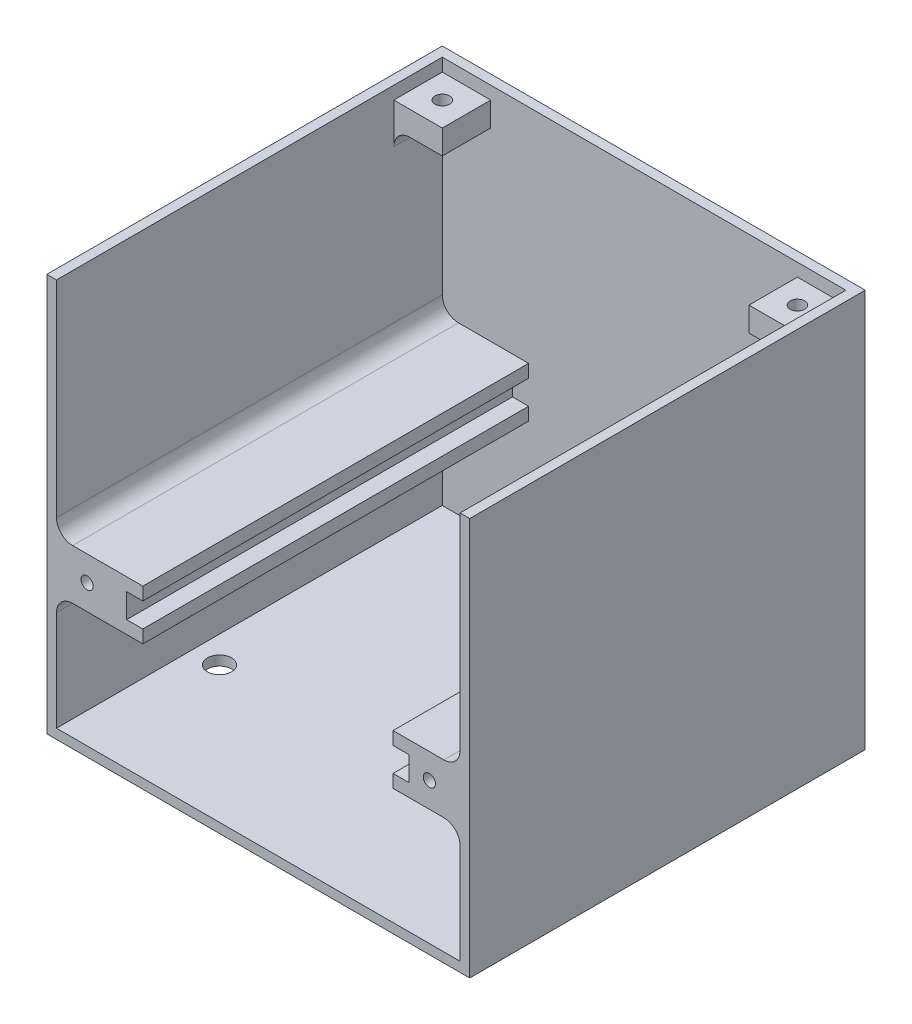
from build123d import *

# Parameters (mm, degrees)
SKETCH1_W           = 52.4
SKETCH1_H           = 49.3
BOSS_EXTRUDE1_DEPTH = 49
CUT_EXTRUDE1_DEPTH  = 47.8
SKETCH3_W           = 6
SKETCH3_H           = 3
BOSS_EXTRUDE2_DEPTH = 6
SKETCH4_R           = 0.75
CUT_EXTRUDE2_DEPTH  = 10
SKETCH5_R           = 1.5
CUT_EXTRUDE3_DEPTH  = 74.491836281
SKETCH6_R           = 0.9
CUT_EXTRUDE4_DEPTH  = 5
FILLET1_R           = 2


with BuildPart() as part:
    # Sketch1 → Boss-Extrude1 (new body)
    with BuildSketch(Plane.XY):
        with Locations((0, 24.65)):
            Rectangle(SKETCH1_W, SKETCH1_H)
    extrude(amount=BOSS_EXTRUDE1_DEPTH)

    # Sketch2 → Cut-Extrude1 (cut)
    with BuildSketch(Plane.XY.offset(49)):
        Polygon((25, 1.2), (25, 15.6), (16.7, 15.6), (16.7, 17.2), (18.7, 17.2), (18.7, 20.2), (16.7, 20.2), (16.7, 21.8), (25, 21.8), (25, 49.3), (-25, 49.3), (-25, 21.8), (-14.3, 21.8), (-14.3, 20.2), (-16.3, 20.2), (-16.3, 17.2), (-14.3, 17.2), (-14.3, 15.6), (-25, 15.6), (-25, 1.2), align=None)
    extrude(amount=-CUT_EXTRUDE1_DEPTH, mode=Mode.SUBTRACT)

    # Sketch3 → Boss-Extrude2 (add)
    with BuildSketch(Plane.XY.offset(1.2)):
        with Locations((-22, 46.2)):
            Rectangle(SKETCH3_W, SKETCH3_H)
        with Locations((22, 46.2)):
            Rectangle(SKETCH3_W, SKETCH3_H)
    extrude(amount=BOSS_EXTRUDE2_DEPTH)

    # Sketch4 → Cut-Extrude2 (cut)
    with BuildSketch(Plane.XY.offset(49)):
        with Locations((-21.2, 18.7)):
            Circle(SKETCH4_R)
        with Locations((21.2, 18.7)):
            Circle(SKETCH4_R)
    extrude(amount=-CUT_EXTRUDE2_DEPTH, mode=Mode.SUBTRACT)

    # Sketch5 → Cut-Extrude3 (cut, through all)
    with BuildSketch(Plane(origin=(0, 1.2, 0), x_dir=(1, 0, 0), z_dir=(0, 1, 0))):
        with Locations(Location((-21.7, -32.1, 0), (0, 0, 270))):
            Circle(SKETCH5_R)
        with Locations(Location((21.3, -27.6, 0), (0, 0, 270))):
            Circle(SKETCH5_R)
    extrude(amount=-CUT_EXTRUDE3_DEPTH, mode=Mode.SUBTRACT)

    # Sketch6 → Cut-Extrude4 (cut)
    with BuildSketch(Plane(origin=(0, 47.7, 0), x_dir=(1, 0, 0), z_dir=(0, 1, 0))):
        with Locations(Location((22, -4.2, 0), (0, 0, 180))):
            Circle(SKETCH6_R)
        with Locations(Location((-22, -4.2, 0), (0, 0, 180))):
            Circle(SKETCH6_R)
    extrude(amount=-CUT_EXTRUDE4_DEPTH, mode=Mode.SUBTRACT)

    # Fillet1
    fillet1_edges = [part.edges().sort_by_distance(p)[0] for p in [
        (-25, 15.6, 25.1),
        (-25, 21.8, 25.1),
        (25, 21.8, 25.1),
        (25, 15.6, 25.1),
        (-25, 44.7, 4.2),
        (25, 44.7, 4.2),
    ]]
    fillet(fillet1_edges, radius=FILLET1_R)


solid = part.part
